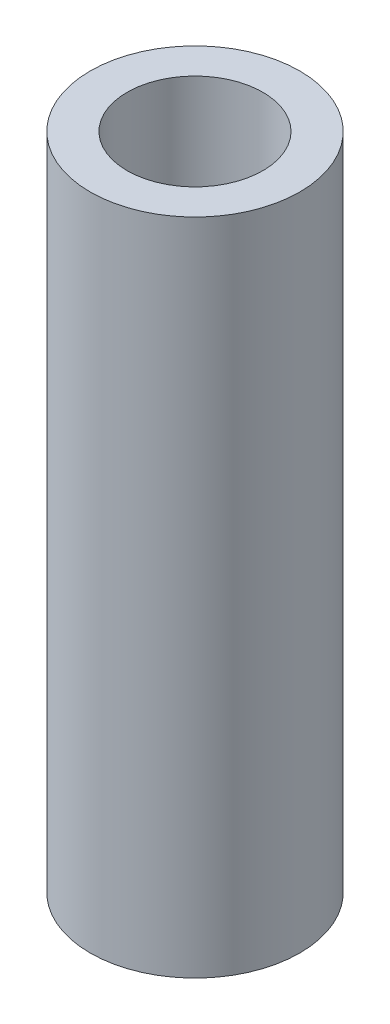
from build123d import *

# Parameters (mm, degrees)
SKETCH1_R                   = 1.5875
BOSS_EXTRUDE1_DEPTH         = 9.9822
F_46_0_081_DIAMETER_HOLE1_D = 2.0574


with BuildPart() as part:
    # Sketch1 → Boss-Extrude1 (new body)
    with BuildSketch(Plane(origin=(0, 0, 0), x_dir=(1, 0, 0), z_dir=(0, 1, 0))):
        with Locations(Location((0, 0, 0), (0, 0, 90))):
            Circle(SKETCH1_R)
    extrude(amount=BOSS_EXTRUDE1_DEPTH)

    # #46 (0.081) Diameter Hole1 (through all)
    with Locations(Plane(origin=(0, 9.9822, 0), x_dir=(1, 0, 0), z_dir=(0, 1, 0))):
        with Locations((0, 0)):
            Hole(F_46_0_081_DIAMETER_HOLE1_D / 2)


solid = part.part
